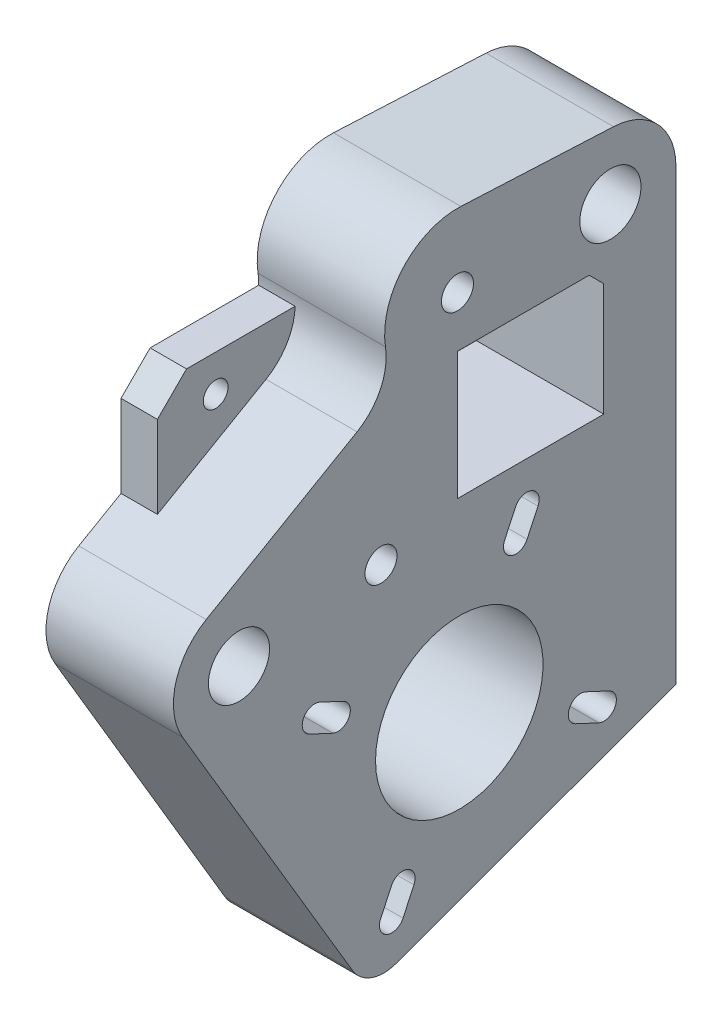
from build123d import *

# Parameters (mm, degrees)
BOSS_EXTRUDE1_DEPTH = 17.5
BOSS_EXTRUDE2_DEPTH = 5
CUT_EXTRUDE1_DEPTH  = 97.898655256
CUT_EXTRUDE2_DEPTH  = 97.898655256
CUT_EXTRUDE3_DEPTH  = 97.898655256
CUT_EXTRUDE4_DEPTH  = 97.898655256
SKETCH7_W           = 20.085317587
SKETCH7_H           = 17.517779008
CUT_EXTRUDE5_DEPTH  = 97.898655256
HOLE1_D             = 3.4
HOLE2_D             = 8.4
HOLE3_D             = 4.4
HOLE4_D             = 23
HOLE5_D             = 8.4
HOLE6_D             = 4.4
FILLET1_R           = 8
CHAMFER3_SIZE       = 4
CHAMFER4_SIZE       = 2
FILLET2_R           = 5
FILLET3_R           = 9
FILLET4_R           = 9


with BuildPart() as part:
    # Sketch1 → Boss-Extrude1 (new body)
    with BuildSketch(Plane(origin=(0, 0, 0), x_dir=(0, -1, 0), z_dir=(-1, 0, 0))):
        with BuildLine():
            Line((11.200465877, 72.380538081), (-8.757531911, 37.812271895))
            ThreePointArc((-8.757531911, 37.812271895), (-19.547871207, 38.906001768), (-24.988655697, 29.523809524))
            Line((-24.988655697, 29.523809524), (-23.581163303, 0))
            Line((-23.581163303, 0), (46.605341047, 0))
            Line((46.605341047, 0), (62.001266902, 42.299958639))
            Line((62.001266902, 42.299958639), (11.200465877, 72.380538081))
        make_face()
    extrude(amount=-BOSS_EXTRUDE1_DEPTH)

    # Sketch2 → Boss-Extrude2 (add)
    with BuildSketch(Plane(origin=(0, 0, 0), x_dir=(0, -1, 0), z_dir=(-1, 0, 0))):
        with BuildLine():
            Line((-8.757531911, 37.812271895), (3.302003533, 58.7))
            Line((3.302003533, 58.7), (-12, 58.7))
            Line((-12, 58.7), (-12, 39.539392014))
            ThreePointArc((-12, 39.539392014), (-10.298772493, 38.82601042), (-8.757531911, 37.812271895))
        make_face()
    extrude(amount=-BOSS_EXTRUDE2_DEPTH)

    # Sketch3 → Cut-Extrude1 (cut, through all)
    with BuildSketch(Plane.ZY):
        with BuildLine():
            Line((18.944189974, -15.937202057), (20.438371168, -19.141483967))
            ThreePointArc((20.438371168, -19.141483967), (22.697545451, -19.96375616), (23.519817644, -17.704581878))
            Line((23.519817644, -17.704581878), (22.02563645, -14.500299967))
            ThreePointArc((22.02563645, -14.500299967), (19.766462167, -13.678027774), (18.944189974, -15.937202057))
        make_face()
    extrude(amount=-CUT_EXTRUDE1_DEPTH, mode=Mode.SUBTRACT)

    # Sketch4 → Cut-Extrude2 (cut, through all)
    with BuildSketch(Plane.ZY):
        with BuildLine():
            Line((48.896933411, -24.280652217), (45.692651501, -25.774833411))
            ThreePointArc((45.692651501, -25.774833411), (44.870379308, -28.034007694), (47.129553591, -28.856279887))
            Line((47.129553591, -28.856279887), (50.333835501, -27.362098693))
            ThreePointArc((50.333835501, -27.362098693), (51.156107694, -25.10292441), (48.896933411, -24.280652217))
        make_face()
    extrude(amount=-CUT_EXTRUDE2_DEPTH, mode=Mode.SUBTRACT)

    # Sketch5 → Cut-Extrude3 (cut, through all)
    with BuildSketch(Plane.ZY):
        with BuildLine():
            Line((35.977855582, -52.466015834), (37.472036775, -55.670297745))
            ThreePointArc((37.472036775, -55.670297745), (39.731211058, -56.492569938), (40.553483251, -54.233395655))
            Line((40.553483251, -54.233395655), (39.059302058, -51.029113744))
            ThreePointArc((39.059302058, -51.029113744), (36.800127775, -50.206841551), (35.977855582, -52.466015834))
        make_face()
    extrude(amount=-CUT_EXTRUDE3_DEPTH, mode=Mode.SUBTRACT)

    # Sketch6 → Cut-Extrude4 (cut, through all)
    with BuildSketch(Plane.ZY):
        with BuildLine():
            Line((10.600739814, -45.889945495), (13.805021724, -44.395764301))
            ThreePointArc((13.805021724, -44.395764301), (14.627293917, -42.136590018), (12.368119634, -41.314317825))
            Line((12.368119634, -41.314317825), (9.163837724, -42.808499019))
            ThreePointArc((9.163837724, -42.808499019), (8.341565531, -45.067673302), (10.600739814, -45.889945495))
        make_face()
    extrude(amount=-CUT_EXTRUDE4_DEPTH, mode=Mode.SUBTRACT)

    # Sketch7 → Cut-Extrude5 (cut, through all)
    with BuildSketch(Plane(origin=(17.5, 0, 0), x_dir=(0, 0, -1), z_dir=(1, 0, 0))):
        with Locations((-19.957341207, -0.762832283)):
            Rectangle(SKETCH7_W, SKETCH7_H)
    extrude(amount=-CUT_EXTRUDE5_DEPTH, mode=Mode.SUBTRACT)

    # Hole1 (through all)
    with Locations(Plane(origin=(5, 0, 0), x_dir=(0, 0, -1), z_dir=(1, 0, 0))):
        with Locations((-50.7, 7)):
            Hole(HOLE1_D / 2)

    # Hole2 (through all)
    with Locations(Plane.ZY):
        with Locations((9, 15)):
            Hole(HOLE2_D / 2)

    # Hole3 (through all)
    with Locations(Plane.ZY):
        with Locations((40.5, -12.150669091)):
            Hole(HOLE3_D / 2)

    # Hole4 (through all)
    with Locations(Plane.ZY):
        with Locations((29.748836613, -35.085298856)):
            Hole(HOLE4_D / 2)

    # Hole5 (through all)
    with Locations(Plane.ZY):
        with Locations((60, -14.444863729)):
            Hole(HOLE5_D / 2)

    # Hole6 (through all)
    with Locations(Plane.ZY):
        with Locations((30, 15)):
            Hole(HOLE6_D / 2)

    # Fillet1
    fillet1_edges = [part.edges().sort_by_distance(p)[0] for p in [
        (11.25, 8.757531911, 37.812271895),
    ]]
    fillet(fillet1_edges, radius=FILLET1_R)

    # Chamfer3
    chamfer3_edges = [part.edges().sort_by_distance(p)[0] for p in [
        (2.5, 12, 58.7),
    ]]
    chamfer(chamfer3_edges, length=CHAMFER3_SIZE)

    # Chamfer4
    chamfer4_edges = [part.edges().sort_by_distance(p)[0] for p in [
        (8.75, 7.996057221, 9.914682413),
    ]]
    chamfer(chamfer4_edges, length=CHAMFER4_SIZE)

    # Fillet2
    fillet2_edges = [part.edges().sort_by_distance(p)[0] for p in [
        (8.75, -62.001266902, 42.299958639),
    ]]
    fillet(fillet2_edges, radius=FILLET2_R)

    # Fillet3
    fillet3_edges = [part.edges().sort_by_distance(p)[0] for p in [
        (8.75, -11.200465877, 72.380538081),
    ]]
    fillet(fillet3_edges, radius=FILLET3_R)

    # Fillet4
    fillet4_edges = [part.edges().sort_by_distance(p)[0] for p in [
        (8.75, 23.581163303, 0),
    ]]
    fillet(fillet4_edges, radius=FILLET4_R)


solid = part.part
